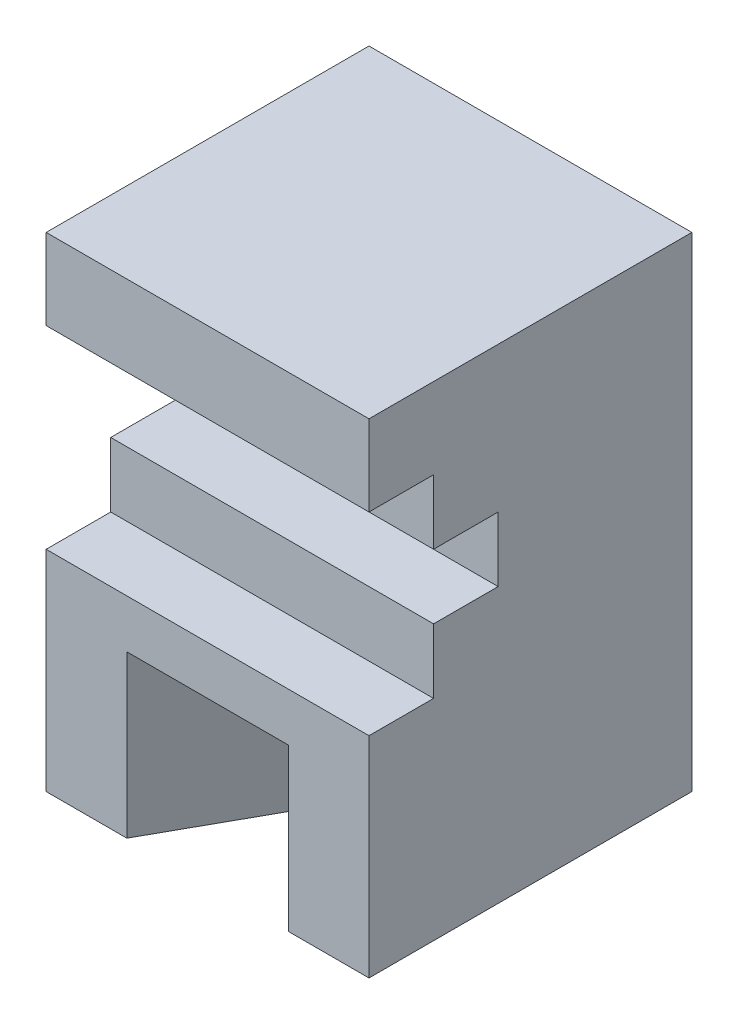
from build123d import *

# Parameters (mm, degrees)
SKETCH1_W           = 100
SKETCH1_H           = 150
BOSS_EXTRUDE1_DEPTH = 100
CUT_EXTRUDE1_DEPTH  = 50
CUT_EXTRUDE2_DEPTH  = 207.155281281


with BuildPart() as part:
    # Sketch1 → Boss-Extrude1 (new body)
    with BuildSketch(Plane.XY):
        with Locations((50, 75)):
            Rectangle(SKETCH1_W, SKETCH1_H)
    extrude(amount=-BOSS_EXTRUDE1_DEPTH)

    # Sketch2 → Cut-Extrude1 (cut)
    with BuildSketch(Plane.XZ):
        Polygon((25, 0), (50, -45), (75, 0), align=None)
    extrude(amount=-CUT_EXTRUDE1_DEPTH, mode=Mode.SUBTRACT)

    # Sketch3 → Cut-Extrude2 (cut, through all)
    with BuildSketch(Plane.ZY):
        Polygon((0, 125), (-20, 125), (-20, 105), (-40, 105), (-40, 85), (-20, 85), (-20, 65), (0, 65), align=None)
    extrude(amount=-CUT_EXTRUDE2_DEPTH, mode=Mode.SUBTRACT)


solid = part.part
